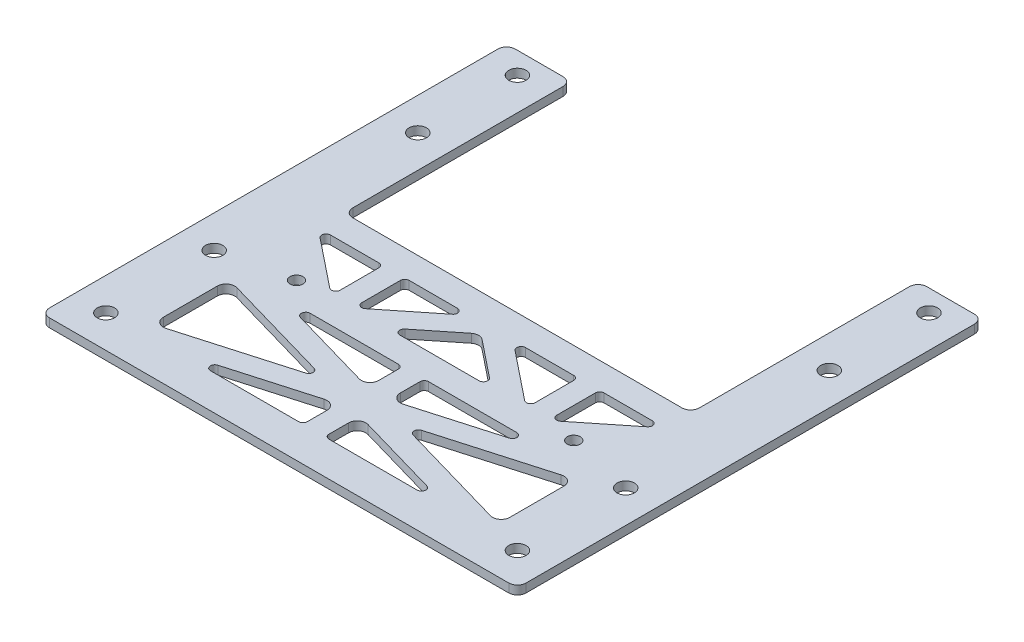
from build123d import *

# Parameters (mm, degrees)
SKETCH_1_R          = 2
SKETCH_1_R_2        = 1.5
EXTRUDE_1_DEPTH     = 2
SKETCH_2_W          = 80
SKETCH_2_H          = 23
CUT_EXTRUDE_1_DEPTH = 121.769408378
SKETCH_3_W          = 5
SKETCH_3_H          = 23
EXTRUDE_2_DEPTH     = 2
FILLET_1_R          = 2
FILLET_2_R          = 1
FILLET_3_R          = 2


with BuildPart() as part:
    # 草图1 → 凸台-拉伸1 (new body)
    with BuildSketch(Plane(origin=(0, 0, 0), x_dir=(1, 0, 0), z_dir=(0, 1, 0))):
        Polygon((55, 107.5), (55, 0), (-55, 0), (-55, 107.5), (-40, 107.5), (-40, 55), (40, 55), (40, 107.5), align=None)
        with Locations(Location((47.5, 32.5, 0), (0, 0, 270))):
            Circle(SKETCH_1_R, mode=Mode.SUBTRACT)
        with Locations(Location((47.5, 7.5, 0), (0, 0, 270))):
            Circle(SKETCH_1_R, mode=Mode.SUBTRACT)
        with Locations(Location((47.5, 79.5, 0), (0, 0, 270))):
            Circle(SKETCH_1_R, mode=Mode.SUBTRACT)
        with Locations(Location((47.5, 102.5, 0), (0, 0, 270))):
            Circle(SKETCH_1_R, mode=Mode.SUBTRACT)
        with Locations(Location((-47.5, 102.5, 0), (0, 0, 90))):
            Circle(SKETCH_1_R, mode=Mode.SUBTRACT)
        with Locations(Location((-47.5, 79.5, 0), (0, 0, 90))):
            Circle(SKETCH_1_R, mode=Mode.SUBTRACT)
        with Locations(Location((-47.5, 7.5, 0), (0, 0, 90))):
            Circle(SKETCH_1_R, mode=Mode.SUBTRACT)
        with Locations(Location((-47.5, 32.5, 0), (0, 0, 90))):
            Circle(SKETCH_1_R, mode=Mode.SUBTRACT)
        with Locations(Location((-32, 36, 0), (0, 0, 270))):
            Circle(SKETCH_1_R_2, mode=Mode.SUBTRACT)
        with Locations(Location((32, 36, 0), (0, 0, 90))):
            Circle(SKETCH_1_R_2, mode=Mode.SUBTRACT)
    extrude(amount=EXTRUDE_1_DEPTH)

    # 草图2 → 切除-拉伸1 (cut, through all)
    with BuildSketch(Plane(origin=(0, 2, 0), x_dir=(1, 0, 0), z_dir=(0, 1, 0))):
        with Locations((0, 19.5)):
            Rectangle(SKETCH_2_W, SKETCH_2_H)
        Polygon((-40, 49), (-25, 37), (-25, 49), align=None)
        Polygon((-20, 49), (-5, 49), (-20, 37), align=None)
        Polygon((0, 46.596875763), (-11.996094703, 37), (11.996094703, 37), align=None)
        Polygon((20, 37), (20, 49), (5, 49), align=None)
        Polygon((25, 49), (40, 49), (25, 37), align=None)
    extrude(amount=-CUT_EXTRUDE_1_DEPTH, mode=Mode.SUBTRACT)

    # 草图3 → 拉伸-薄壁2 (add)
    with BuildSketch(Plane(origin=(0, 2, 0), x_dir=(1, 0, 0), z_dir=(0, 1, 0))):
        Polygon((-40.690768562, 28.59732674), (39.309231438, 5.59732674), (40.690768562, 10.40267326), (-39.309231438, 33.40267326), align=None)
        Polygon((-39.309231438, 5.59732674), (40.690768562, 28.59732674), (39.309231438, 33.40267326), (-40.690768562, 10.40267326), align=None)
        with Locations((0, 19.5)):
            Rectangle(SKETCH_3_W, SKETCH_3_H)
    extrude(amount=-EXTRUDE_2_DEPTH)

    # 圆角1
    fillet_1_edges = [part.edges().sort_by_distance(p)[0] for p in [
        (55, 1, -107.5),
        (55, 1, 0),
        (-55, 1, 0),
        (-55, 1, -107.5),
        (-40, 1, -107.5),
        (-40, 1, -55),
        (40, 1, -55),
        (40, 1, -107.5),
    ]]
    fillet(fillet_1_edges, radius=FILLET_1_R)

    # 圆角2
    fillet_2_edges = [part.edges().sort_by_distance(p)[0] for p in [
        (-20, 1, -49),
        (-5, 1, -49),
        (-40, 1, -49),
        (-25, 1, -49),
        (-25, 1, -37),
        (25, 1, -37),
        (25, 1, -49),
        (40, 1, -49),
        (-30.952107056, 1, -8),
        (30.952107056, 1, -8),
        (30.952107056, 1, -31),
        (-30.952107056, 1, -31),
        (-9.047892944, 1, -19.5),
        (9.047892944, 1, -19.5),
        (2.5, 1, -31),
        (-2.5, 1, -31),
        (-2.5, 1, -8),
        (2.5, 1, -8),
        (11.996094703, 1, -37),
        (-11.996094703, 1, -37),
        (20, 1, -37),
        (5, 1, -49),
        (20, 1, -49),
        (-20, 1, -37),
    ]]
    fillet(fillet_2_edges, radius=FILLET_2_R)

    # 圆角3
    fillet_3_edges = [part.edges().sort_by_distance(p)[0] for p in [
        (40, 1, -28.398730779),
        (40, 1, -10.601269221),
        (-40, 1, -10.601269221),
        (-40, 1, -28.398730779),
        (-2.5, 1, -22.820019221),
        (2.5, 1, -16.179980779),
        (2.5, 1, -22.820019221),
        (-2.5, 1, -16.179980779),
        (0, 1, -46.596875763),
    ]]
    fillet(fillet_3_edges, radius=FILLET_3_R)


solid = part.part
